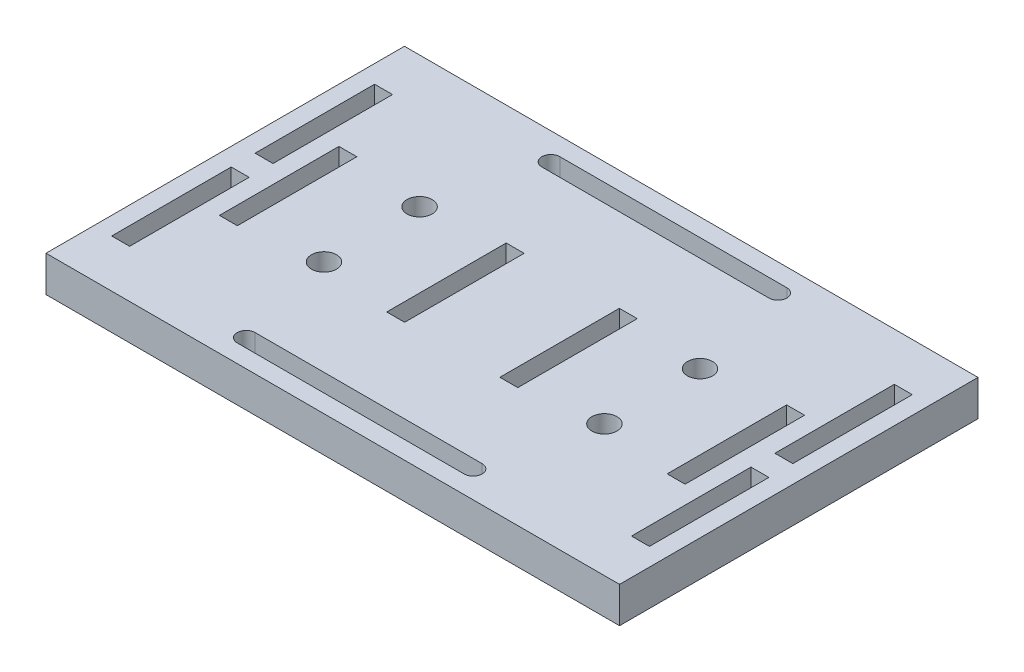
from build123d import *

# Parameters (mm, degrees)
SKETCH_1_W      = 96
SKETCH_1_H      = 60
SKETCH_1_R      = 2.1
SKETCH_1_W_2    = 3
SKETCH_1_H_2    = 20
EXTRUDE_1_DEPTH = 6


with BuildPart() as part:
    # 草图1 → 凸台-拉伸1 (new body)
    with BuildSketch(Plane(origin=(0, 0, 0), x_dir=(1, 0, 0), z_dir=(0, 1, 0))):
        with Locations((53.5, -30)):
            Rectangle(SKETCH_1_W, SKETCH_1_H)
        with BuildLine():
            Line((72.5, -57), (34.5, -57))
            ThreePointArc((34.5, -57), (33, -55.5), (34.5, -54))
            Line((34.5, -54), (72.5, -54))
            ThreePointArc((72.5, -54), (74, -55.5), (72.5, -57))
        make_face(mode=Mode.SUBTRACT)
        with BuildLine():
            Line((72.5, -6), (34.5, -6))
            ThreePointArc((34.5, -6), (33, -4.5), (34.5, -3))
            Line((34.5, -3), (72.5, -3))
            ThreePointArc((72.5, -3), (74, -4.5), (72.5, -6))
        make_face(mode=Mode.SUBTRACT)
        with Locations(Location((76.969497546, -38, 0), (0, 0, 270))):
            Circle(SKETCH_1_R, mode=Mode.SUBTRACT)
        with Locations((62.969497546, -30)):
            Rectangle(SKETCH_1_W_2, SKETCH_1_H_2, mode=Mode.SUBTRACT)
        with Locations((97, -42)):
            Rectangle(SKETCH_1_W_2, SKETCH_1_H_2, mode=Mode.SUBTRACT)
        with Locations(Location((76.969497546, -22, 0), (0, 0, 270))):
            Circle(SKETCH_1_R, mode=Mode.SUBTRACT)
        with Locations((90.969497546, -30)):
            Rectangle(SKETCH_1_W_2, SKETCH_1_H_2, mode=Mode.SUBTRACT)
        with Locations((97, -18)):
            Rectangle(SKETCH_1_W_2, SKETCH_1_H_2, mode=Mode.SUBTRACT)
        with Locations((10, -18)):
            Rectangle(SKETCH_1_W_2, SKETCH_1_H_2, mode=Mode.SUBTRACT)
        with Locations(Location((30.030502454, -22, 0), (0, 0, 270))):
            Circle(SKETCH_1_R, mode=Mode.SUBTRACT)
        with Locations((10, -42)):
            Rectangle(SKETCH_1_W_2, SKETCH_1_H_2, mode=Mode.SUBTRACT)
        Polygon((14.530502454, -40), (14.530502454, -20), (17.530502454, -20), (17.530502454, -30), (17.530502454, -40), align=None, mode=Mode.SUBTRACT)
        with Locations(Location((30.030502454, -38, 0), (0, 0, 270))):
            Circle(SKETCH_1_R, mode=Mode.SUBTRACT)
        Polygon((42.530502454, -40), (42.530502454, -30), (42.530502454, -20), (45.530502454, -20), (45.530502454, -40), align=None, mode=Mode.SUBTRACT)
    extrude(amount=EXTRUDE_1_DEPTH)


solid = part.part
